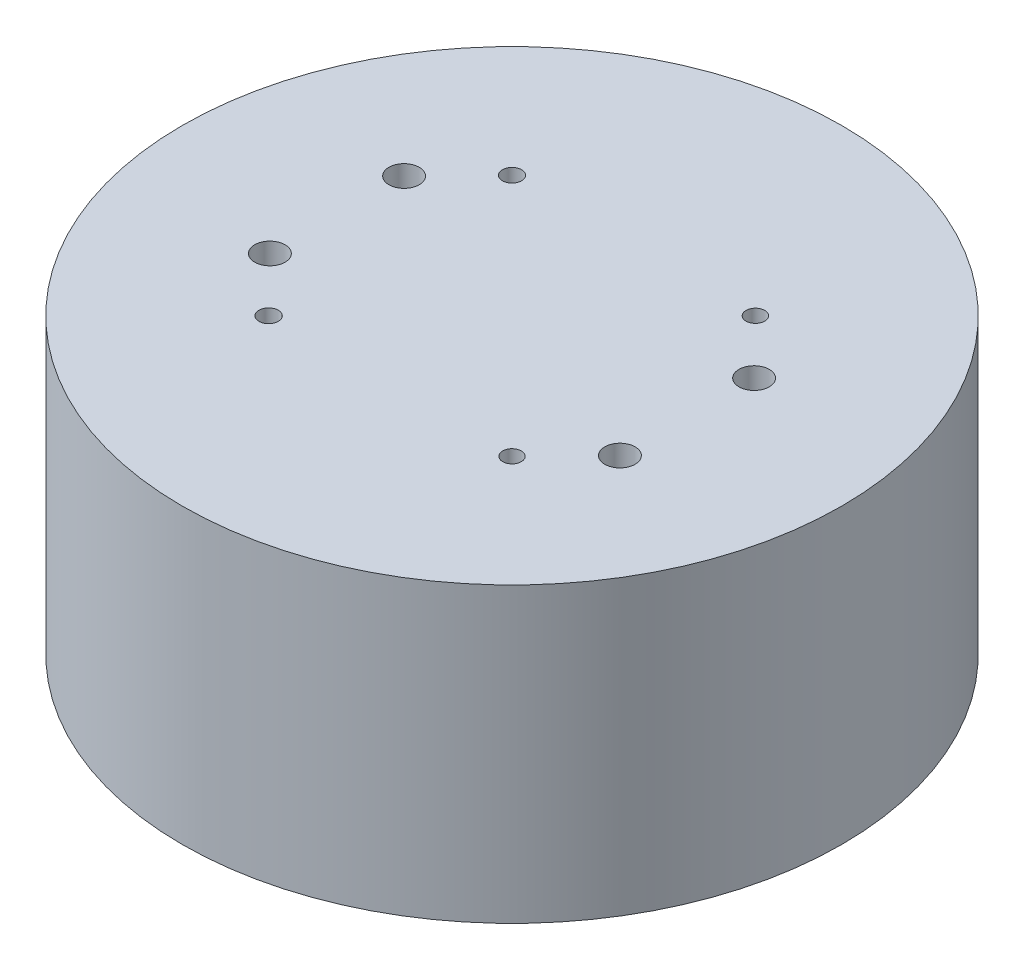
from build123d import *
from build123d.topology import SkipClean

# Parameters (mm, degrees)
SKETCH2_R                = 56.515
SKETCH2_R_2              = 51.435
BOSS_EXTRUDE1_DEPTH      = 35
SKETCH2_R_3              = 47.201666667
SKETCH2_R_4              = 42.121666667
BOSS_EXTRUDE1_2_DEPTH    = 35
SKETCH3_R                = 56.515
BOSS_EXTRUDE2_DEPTH      = 15.24
CUT_EXTRUDE1_DEPTH       = 95.40311462
CUT_EXTRUDE1_DEPTH_BACK  = 95.40311462
SKETCH4_R                = 1.6
SKETCH4_R_2              = 1.65876763
SKETCH4_R_3              = 1.651
CUT_EXTRUDE18_REACH      = 96.403
SKETCH32_R               = 2.6
SKETCH_1_R               = 6
CUT_EXTRUDE_1_DEPTH      = 5
CUT_EXTRUDE_2_REACH      = 137.992
CUT_EXTRUDE_2_END_RADIUS = 42.121666667
SKETCH_3_R               = 10
SKETCH_4_R               = 15
SKETCH_4_R_2             = 10
EXTRUDE_1_DEPTH          = 17.154678362
SKETCH_10_W              = 5
SKETCH_10_H              = 4.233333333
SKETCH_10_H_2            = 4.444320869
EXTRUDE_3_DEPTH          = 33
CUT_EXTRUDE_START        = -40
SKETCH_11_R              = 61.515
SKETCH_11_R_2            = 56.515
CUT_EXTRUDE_3_DEPTH      = 30
SKETCH_15_W              = 2.458765136
SKETCH_15_H              = 28
EXTRUDE_9_DEPTH          = 5


with BuildPart() as part:
    # Sketch2 → Boss-Extrude1 (new body)
    with BuildSketch(Plane(origin=(0, 0, 0), x_dir=(1, 0, 0), z_dir=(0, 1, 0))):
        with Locations(Location((0, 0, 0), (0, 0, 270))):
            Circle(SKETCH2_R)
        with Locations(Location((0, 0, 0), (0, 0, 270))):
            Circle(SKETCH2_R_2, mode=Mode.SUBTRACT)
    extrude(amount=BOSS_EXTRUDE1_DEPTH)



with BuildPart() as body_2:
    # Sketch2 → Boss-Extrude1 2 (new body)
    with BuildSketch(Plane(origin=(0, 0, 0), x_dir=(1, 0, 0), z_dir=(0, 1, 0))):
        with Locations(Location((0, 0, 0), (0, 0, 270))):
            Circle(SKETCH2_R_3)
        with Locations(Location((0, 0, 0), (0, 0, 270))):
            Circle(SKETCH2_R_4, mode=Mode.SUBTRACT)
    extrude(amount=BOSS_EXTRUDE1_2_DEPTH)


with BuildPart() as part_1:
    add(part.part)

    add(body_2.part)  # Boss-Extrude2 merges body 2
    # Sketch3 → Boss-Extrude2 (add)
    with BuildSketch(Plane(origin=(0, 35, 0), x_dir=(1, 0, 0), z_dir=(0, 1, 0))):
        with Locations(Location((0, 0, 0), (0, 0, 270))):
            Circle(SKETCH3_R)
    extrude(amount=BOSS_EXTRUDE2_DEPTH)

    # Sketch4 → Cut-Extrude1 (cut, two sides: drawn at the far end of the back side and taken through both)
    with BuildSketch(Plane(origin=(0, 50.24, 0), x_dir=(1, 0, 0), z_dir=(0, 1, 0)).offset(-CUT_EXTRUDE1_DEPTH_BACK)):
        with Locations(Location((20.859650045, 20.859650045, 0), (0, 0, 270))):
            Circle(SKETCH4_R)
        with Locations(Location((20.859650045, -20.859650045, 0), (0, 0, 270))):
            Circle(SKETCH4_R)
        with Locations(Location((-20.859650045, -20.859650045, 0), (0, 0, 270))):
            Circle(SKETCH4_R_2)
        with Locations(Location((-20.859650045, 20.859650045, 0), (0, 0, 270))):
            Circle(SKETCH4_R_3)
    extrude(amount=CUT_EXTRUDE1_DEPTH + CUT_EXTRUDE1_DEPTH_BACK, mode=Mode.SUBTRACT)

    # Sketch32 → Cut-Extrude18 (cut, up to next)
    with BuildSketch(Plane(origin=(0, 50.24, 0), x_dir=(1, 0, 0), z_dir=(0, 1, 0)), mode=Mode.PRIVATE) as cut_extrude18_sk1:
        with Locations(Location((30, 11.5, 0), (0, 0, 270))):
            Circle(SKETCH32_R)
    cut_extrude18_tool1 = extrude(cut_extrude18_sk1.sketch, amount=-CUT_EXTRUDE18_REACH, mode=Mode.PRIVATE) & part_1.part
    # Sketch32 → Cut-Extrude18 (cut, up to next)
    with BuildSketch(Plane(origin=(0, 50.24, 0), x_dir=(1, 0, 0), z_dir=(0, 1, 0)), mode=Mode.PRIVATE) as cut_extrude18_sk2:
        with Locations(Location((30, -11.5, 0), (0, 0, 270))):
            Circle(SKETCH32_R)
    cut_extrude18_tool2 = extrude(cut_extrude18_sk2.sketch, amount=-CUT_EXTRUDE18_REACH, mode=Mode.PRIVATE) & part_1.part
    # Sketch32 → Cut-Extrude18 (cut, up to next)
    with BuildSketch(Plane(origin=(0, 50.24, 0), x_dir=(1, 0, 0), z_dir=(0, 1, 0)), mode=Mode.PRIVATE) as cut_extrude18_sk3:
        with Locations(Location((-30, -11.5, 0), (0, 0, 270))):
            Circle(SKETCH32_R)
    cut_extrude18_tool3 = extrude(cut_extrude18_sk3.sketch, amount=-CUT_EXTRUDE18_REACH, mode=Mode.PRIVATE) & part_1.part
    # Sketch32 → Cut-Extrude18 (cut, up to next)
    with BuildSketch(Plane(origin=(0, 50.24, 0), x_dir=(1, 0, 0), z_dir=(0, 1, 0)), mode=Mode.PRIVATE) as cut_extrude18_sk4:
        with Locations(Location((-30, 11.5, 0), (0, 0, 270))):
            Circle(SKETCH32_R)
    cut_extrude18_tool4 = extrude(cut_extrude18_sk4.sketch, amount=-CUT_EXTRUDE18_REACH, mode=Mode.PRIVATE) & part_1.part
    add(cut_extrude18_tool1.solids().sort_by_distance((30, 50.24, -11.5))[0], mode=Mode.SUBTRACT)
    add(cut_extrude18_tool2.solids().sort_by_distance((30, 50.24, 11.5))[0], mode=Mode.SUBTRACT)
    add(cut_extrude18_tool3.solids().sort_by_distance((-30, 50.24, 11.5))[0], mode=Mode.SUBTRACT)
    add(cut_extrude18_tool4.solids().sort_by_distance((-30, 50.24, -11.5))[0], mode=Mode.SUBTRACT)

    # 草图1 → 切除-拉伸1 (cut)
    with BuildSketch(Plane(origin=(0, 35, 0), x_dir=(-1, 0, 0), z_dir=(0, -1, 0))):
        with Locations(Location((30, 11.5, 0), (0, 0, 90))):
            Circle(SKETCH_1_R)
        with Locations(Location((30, -11.5, 0), (0, 0, 90))):
            Circle(SKETCH_1_R)
        with Locations(Location((-30, 11.5, 0), (0, 0, 90))):
            Circle(SKETCH_1_R)
        with Locations(Location((-30, -11.5, 0), (0, 0, 90))):
            Circle(SKETCH_1_R)
    extrude(amount=-CUT_EXTRUDE_1_DEPTH, mode=Mode.SUBTRACT)

    # 切除-拉伸2: up to this cylinder (the profile starts outside it)
    cut_extrude_2_end = Plane(origin=(0, 25, 0), z_dir=(0, -1, 0)) * Cylinder(CUT_EXTRUDE_2_END_RADIUS, 361.227333333, mode=Mode.PRIVATE)
    # 草图3 → 切除-拉伸2 (cut, up to the surface)
    with BuildSketch(Plane.XY.offset(-56.515), mode=Mode.PRIVATE) as cut_extrude_2_sk1:
        with Locations(Location((0, 25, 0), (0, 0, 270))):
            Circle(SKETCH_3_R)
    cut_extrude_2_tool1 = extrude(cut_extrude_2_sk1.sketch, amount=CUT_EXTRUDE_2_REACH, mode=Mode.PRIVATE) - cut_extrude_2_end
    add(cut_extrude_2_tool1.solids().sort_by_distance((0, 25, -56.515))[0], mode=Mode.SUBTRACT)

    # 草图4 → 拉伸-薄壁1 (add)
    with SkipClean():  # the faces are left unmerged after this step: merging them gives an invalid solid
        with BuildSketch(Plane.XY.offset(-56.515)):
            with Locations((0, 25)):
                Circle(SKETCH_4_R)
            with Locations((0, 25)):
                Circle(SKETCH_4_R_2, mode=Mode.SUBTRACT)
        extrude(amount=EXTRUDE_1_DEPTH)

    # 草图10 → 拉伸-薄壁3 (add)
    with SkipClean():  # the faces are left unmerged after this step: merging them gives an invalid solid
        with BuildSketch(Plane(origin=(0, 7, 0), x_dir=(1, 0, 0), z_dir=(0, 1, 0))):
            with Locations((2.5, 49.318333334)):
                Rectangle(SKETCH_10_W, SKETCH_10_H)
            with Locations((-12.5, 46.977018675)):
                Rectangle(SKETCH_10_W, SKETCH_10_H_2)
            with Locations((17.5, 46.977018675)):
                Rectangle(SKETCH_10_W, SKETCH_10_H_2)
            with BuildLine():
                ThreePointArc((15.089267159, 49.171874498), (0, 51.435), (-15.089267159, 49.171874498))
                Line((-15.089267159, 49.171874498), (-16.55609589, 53.951875907))
                ThreePointArc((-16.55609589, 53.951875907), (0, 56.435), (16.55609589, 53.951875907))
                Line((16.55609589, 53.951875907), (15.089267159, 49.171874498))
            make_face()
            with BuildLine():
                ThreePointArc((15.111664358, 44.717277829), (0, 47.201666667), (-15.111664358, 44.717277829))
                Line((-15.111664358, 44.717277829), (-16.712419736, 49.454110338))
                ThreePointArc((-16.712419736, 49.454110338), (0, 52.201666667), (16.712419736, 49.454110338))
                Line((16.712419736, 49.454110338), (15.111664358, 44.717277829))
            make_face()
        extrude(amount=EXTRUDE_3_DEPTH)

    # 草图11 → 切除-拉伸-薄壁3 (cut)
    with SkipClean():  # the faces are left unmerged after this step: merging them gives an invalid solid
        with BuildSketch(Plane(origin=(0, 0, 0), x_dir=(-1, 0, 0), z_dir=(0, -1, 0)).offset(CUT_EXTRUDE_START)):
            Circle(SKETCH_11_R)
            Circle(SKETCH_11_R_2, mode=Mode.SUBTRACT)
        extrude(amount=CUT_EXTRUDE_3_DEPTH, mode=Mode.SUBTRACT)

    # 草图15 → 凸台-拉伸9 (add)
    with BuildSketch(Plane(origin=(20, 0, 0), x_dir=(0, 0, -1), z_dir=(1, 0, 0))):
        with Locations((43.525475672, 21)):
            Rectangle(SKETCH_15_W, SKETCH_15_H)
    extrude(amount=-EXTRUDE_9_DEPTH)


solid = part_1.part
